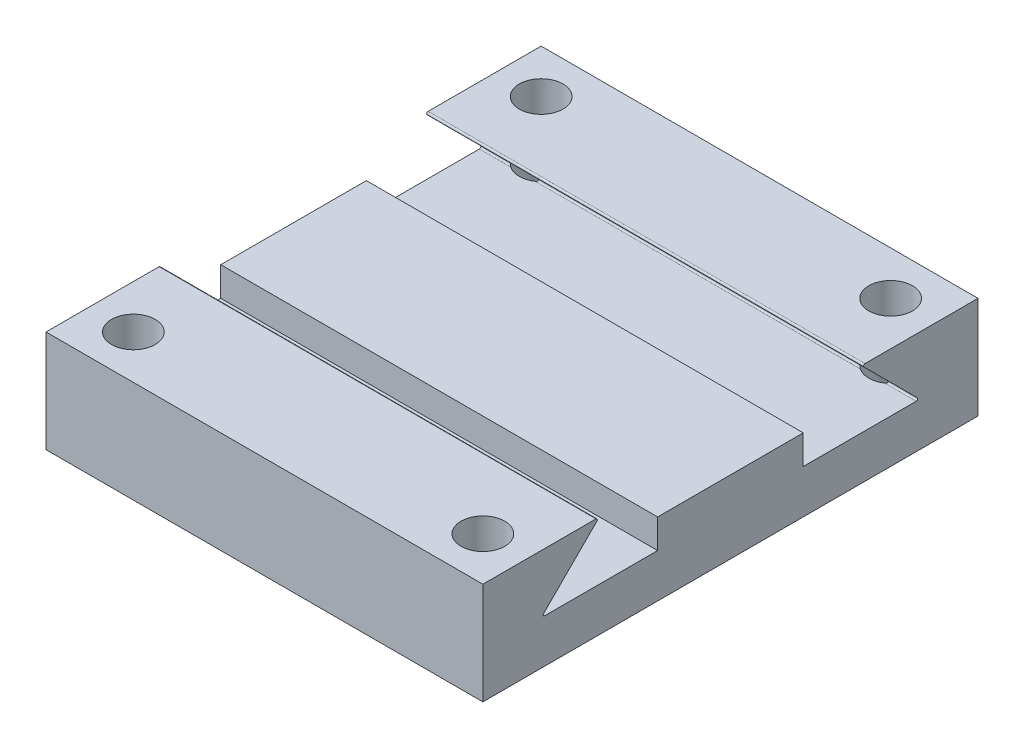
from build123d import *

# Parameters (mm, degrees)
SKETCH1_W           = 30
SKETCH1_H           = 34
BOSS_EXTRUDE1_DEPTH = 3
SKETCH2_W           = 30
SKETCH2_H           = 8
BOSS_EXTRUDE2_DEPTH = 4
CUT_EXTRUDE2_DEPTH  = 30
FILLET4_R           = 0.1
FILLET5_R           = 0.1
FILLET6_R           = 0.1
FILLET7_R           = 0.1
SKETCH5_R           = 1.5
CUT_EXTRUDE3_DEPTH  = 30
SKETCH7_W           = 30
SKETCH7_H           = 10
BOSS_EXTRUDE3_DEPTH = 2


with BuildPart() as part:
    # Sketch1 → Boss-Extrude1 (new body)
    with BuildSketch(Plane(origin=(0, 0, 0), x_dir=(1, 0, 0), z_dir=(0, 1, 0))):
        Rectangle(SKETCH1_W, SKETCH1_H)
    extrude(amount=BOSS_EXTRUDE1_DEPTH)

    # Sketch2 → Boss-Extrude2 (add)
    with BuildSketch(Plane(origin=(0, 3, 0), x_dir=(1, 0, 0), z_dir=(0, 1, 0))):
        with Locations((0, -13)):
            Rectangle(SKETCH2_W, SKETCH2_H)
        with Locations((0, 13)):
            Rectangle(SKETCH2_W, SKETCH2_H)
    extrude(amount=BOSS_EXTRUDE2_DEPTH)

    # Sketch4 → Cut-Extrude2 (cut)
    with BuildSketch(Plane(origin=(15, 0, 0), x_dir=(0, 0, -1), z_dir=(1, 0, 0))):
        Polygon((-9, 3), (-13, 3), (-9, 7), align=None)
        Polygon((9, 3), (13, 3), (9, 7), align=None)
    extrude(amount=-CUT_EXTRUDE2_DEPTH, mode=Mode.SUBTRACT)

    # Fillet4
    fillet4_edges = [part.edges().sort_by_distance(p)[0] for p in [
        (0, 7, 9),
    ]]
    fillet(fillet4_edges, radius=FILLET4_R)

    # Fillet5
    fillet5_edges = [part.edges().sort_by_distance(p)[0] for p in [
        (0, 3, 13),
    ]]
    fillet(fillet5_edges, radius=FILLET5_R)

    # Fillet6
    fillet6_edges = [part.edges().sort_by_distance(p)[0] for p in [
        (0, 3, -13),
    ]]
    fillet(fillet6_edges, radius=FILLET6_R)

    # Fillet7
    fillet7_edges = [part.edges().sort_by_distance(p)[0] for p in [
        (0, 7, -9),
    ]]
    fillet(fillet7_edges, radius=FILLET7_R)

    # Sketch5 → Cut-Extrude3 (cut)
    with BuildSketch(Plane(origin=(0, 7, 0), x_dir=(1, 0, 0), z_dir=(0, 1, 0))):
        with Locations(Location((-12, 14, 0), (0, 0, 270))):
            Circle(SKETCH5_R)
        with Locations(Location((12, 14, 0), (0, 0, 270))):
            Circle(SKETCH5_R)
        with Locations(Location((-12, -14, 0), (0, 0, 270))):
            Circle(SKETCH5_R)
        with Locations(Location((12, -14, 0), (0, 0, 270))):
            Circle(SKETCH5_R)
    extrude(amount=-CUT_EXTRUDE3_DEPTH, mode=Mode.SUBTRACT)

    # Sketch7 → Boss-Extrude3 (add)
    with BuildSketch(Plane(origin=(0, 3, 0), x_dir=(1, 0, 0), z_dir=(0, 1, 0))):
        Rectangle(SKETCH7_W, SKETCH7_H)
    extrude(amount=BOSS_EXTRUDE3_DEPTH)


solid = part.part
